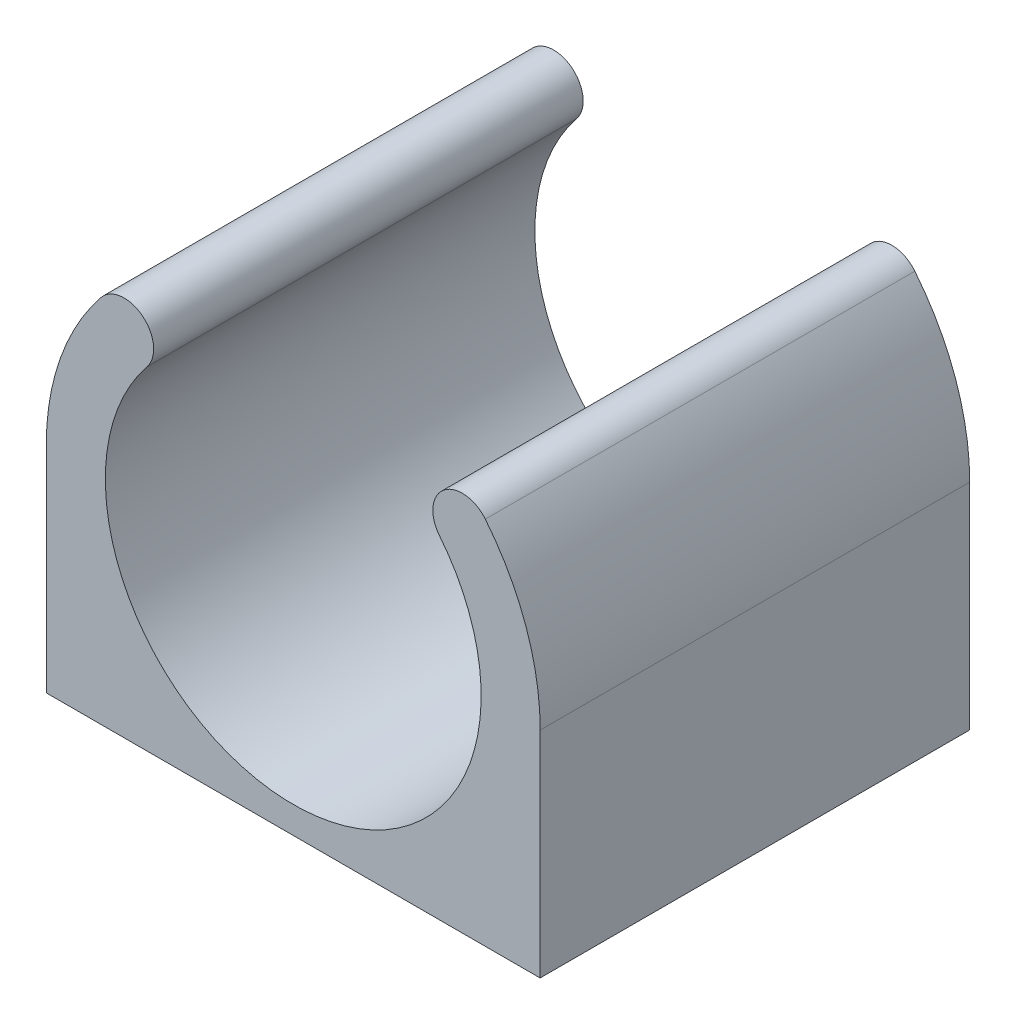
from build123d import *

# Parameters (mm, degrees)
EXTRUDE_1_DEPTH = 4


with BuildPart() as part:
    # 草图1 → 凸台-拉伸1 (new body)
    with BuildSketch(Plane.XY):
        with BuildLine():
            Line((-2.299083407, -2), (2.299083407, -2))
            Line((2.299083407, -2), (2.3, 0))
            ThreePointArc((2.3, 0), (2.16844499, 0.76671137), (1.788829283, 1.445714286))
            ThreePointArc((1.788829283, 1.445714286), (1.402090378, 1.486738905), (1.361065759, 1.1))
            ThreePointArc((1.361065759, 1.1), (0, -1.75), (-1.361065759, 1.1))
            ThreePointArc((-1.361065759, 1.1), (-1.402090378, 1.486738905), (-1.788829283, 1.445714286))
            ThreePointArc((-1.788829283, 1.445714286), (-2.16844499, 0.76671137), (-2.3, 0))
            Line((-2.3, 0), (-2.299083407, -2))
        make_face()
    extrude(amount=EXTRUDE_1_DEPTH)


solid = part.part
